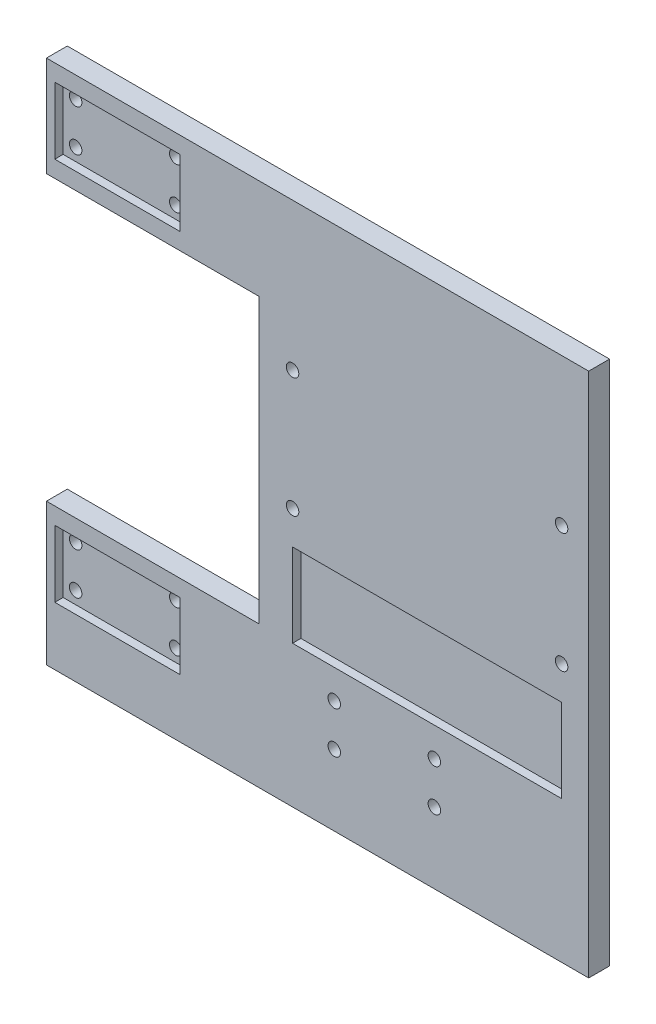
from build123d import *

# Parameters (mm, degrees)
EXTRUDE_2_DEPTH      = 5
SKETCH_3_W           = 30
SKETCH_3_H           = 16.1
CUT_EXTRUDE_1_DEPTH  = 2
CUT_EXTRUDE_2_REACH  = 155.704
SKETCH_4_R           = 1.55
CUT_EXTRUDE_3_REACH  = 155.756
SKETCH_5_W           = 32
SKETCH_5_H           = 56
SKETCH_7_W           = 40.5
SKETCH_7_H           = 40.5
EXTRUDE_4_DEPTH      = 2
SKETCH_8_W           = 30.5
SKETCH_8_H           = 16.5
CUT_EXTRUDE_4_DEPTH  = 2
SKETCH_9_R           = 1.55
CUT_EXTRUDE_6_DEPTH  = 154.727030805
SKETCH_10_W          = 60
SKETCH_10_H          = 45
EXTRUDE_5_DEPTH      = 2
SKETCH_11_W          = 60
SKETCH_11_H          = 45
CUT_EXTRUDE_8_DEPTH  = 2
SKETCH_12_W          = 30
SKETCH_12_H          = 16.1
SKETCH_12_W_2        = 30.5
SKETCH_12_H_2        = 16.5
EXTRUDE_6_DEPTH      = 5
SKETCH_13_R          = 1.5
CUT_EXTRUDE_10_DEPTH = 5
SKETCH_14_W          = 30
SKETCH_14_H          = 16
CUT_EXTRUDE_11_DEPTH = 2
SKETCH_15_W          = 53
SKETCH_15_H          = 60
SKETCH_15_W_2        = 49
SKETCH_15_H_2        = 56
CUT_EXTRUDE_12_DEPTH = 5
SKETCH_16_W          = 30
SKETCH_16_H          = 16
CUT_EXTRUDE_13_DEPTH = 2
SKETCH_17_R          = 1.5
CUT_EXTRUDE_15_DEPTH = 154.704261489
EXTRUDE_7_DEPTH      = 5
SKETCH_19_W          = 30
SKETCH_19_H          = 16
EXTRUDE_8_DEPTH      = 5
SKETCH_20_W          = 72
SKETCH_20_H          = 36.7
SKETCH_20_W_2        = 30
SKETCH_20_H_2        = 16
CUT_EXTRUDE_17_DEPTH = 2
SKETCH_21_R          = 1.5
CUT_EXTRUDE_18_DEPTH = 162.632298752
SKETCH_22_R          = 1.5
EXTRUDE_10_DEPTH     = 3
SKETCH_23_R          = 1.5
CUT_EXTRUDE_19_DEPTH = 162.632298752
SKETCH_24_W          = 72
SKETCH_24_H          = 36.7
SKETCH_24_R          = 1.5
EXTRUDE_11_DEPTH     = 5
SKETCH_26_W          = 30
SKETCH_26_H          = 16
SKETCH_26_R          = 1.5
EXTRUDE_12_DEPTH     = 5
SKETCH_27_W          = 51
SKETCH_27_H          = 4
CUT_EXTRUDE_22_DEPTH = 5
SKETCH_29_W          = 64.5
SKETCH_29_H          = 20
CUT_EXTRUDE_24_DEPTH = 2


with BuildPart() as part:
    # 草图1 → 凸台-拉伸2 (new body)
    with BuildSketch(Plane.XY):
        Polygon((0, 0), (0, 30), (120, 30), (120, -96), (0, -96), (0, -56), (45, -56), (45, 0), align=None)
    extrude(amount=EXTRUDE_2_DEPTH)

    # 草图3 → 切除-拉伸1 (cut)
    with BuildSketch(Plane.XY.offset(5)):
        with Locations((17, 10)):
            Rectangle(SKETCH_3_W, SKETCH_3_H)
        with Locations((17, -66)):
            Rectangle(SKETCH_3_W, SKETCH_3_H)
    extrude(amount=-CUT_EXTRUDE_1_DEPTH, mode=Mode.SUBTRACT)

    # 草图4 → 切除-拉伸2 (cut, up to next)
    with BuildSketch(Plane.XY.offset(3), mode=Mode.PRIVATE) as cut_extrude_2_sk1:
        with Locations((29, 15)):
            Circle(SKETCH_4_R)
    cut_extrude_2_tool1 = extrude(cut_extrude_2_sk1.sketch, amount=-CUT_EXTRUDE_2_REACH, mode=Mode.PRIVATE) & part.part
    # 草图4 → 切除-拉伸2 (cut, up to next)
    with BuildSketch(Plane.XY.offset(3), mode=Mode.PRIVATE) as cut_extrude_2_sk2:
        with Locations((29, 5)):
            Circle(SKETCH_4_R)
    cut_extrude_2_tool2 = extrude(cut_extrude_2_sk2.sketch, amount=-CUT_EXTRUDE_2_REACH, mode=Mode.PRIVATE) & part.part
    # 草图4 → 切除-拉伸2 (cut, up to next)
    with BuildSketch(Plane.XY.offset(3), mode=Mode.PRIVATE) as cut_extrude_2_sk3:
        with BuildLine():
            ThreePointArc((5, 16.55), (3.903984489, 16.096015511), (3.45, 15))
            Line((3.45, 15), (5, 15))
            Line((5, 15), (5, 16.55))
        make_face()
    cut_extrude_2_tool3 = extrude(cut_extrude_2_sk3.sketch, amount=-CUT_EXTRUDE_2_REACH, mode=Mode.PRIVATE) & part.part
    # 草图4 → 切除-拉伸2 (cut, up to next)
    with BuildSketch(Plane.XY.offset(3), mode=Mode.PRIVATE) as cut_extrude_2_sk4:
        with BuildLine():
            Line((5, 15), (3.45, 15))
            ThreePointArc((3.45, 15), (5, 13.45), (6.55, 15))
            ThreePointArc((6.55, 15), (6.096015511, 16.096015511), (5, 16.55))
            Line((5, 16.55), (5, 15))
        make_face()
    cut_extrude_2_tool4 = extrude(cut_extrude_2_sk4.sketch, amount=-CUT_EXTRUDE_2_REACH, mode=Mode.PRIVATE) & part.part
    # 草图4 → 切除-拉伸2 (cut, up to next)
    with BuildSketch(Plane.XY.offset(3), mode=Mode.PRIVATE) as cut_extrude_2_sk5:
        with BuildLine():
            ThreePointArc((5, 16.55), (3.903984489, 16.096015511), (3.45, 15))
            Line((3.45, 15), (5, 15))
            Line((5, 15), (5, 16.55))
        make_face()
    cut_extrude_2_tool5 = extrude(cut_extrude_2_sk5.sketch, amount=-CUT_EXTRUDE_2_REACH, mode=Mode.PRIVATE) & part.part
    # 草图4 → 切除-拉伸2 (cut, up to next)
    with BuildSketch(Plane.XY.offset(3), mode=Mode.PRIVATE) as cut_extrude_2_sk6:
        with BuildLine():
            Line((5, 15), (3.45, 15))
            ThreePointArc((3.45, 15), (5, 13.45), (6.55, 15))
            ThreePointArc((6.55, 15), (6.096015511, 16.096015511), (5, 16.55))
            Line((5, 16.55), (5, 15))
        make_face()
    cut_extrude_2_tool6 = extrude(cut_extrude_2_sk6.sketch, amount=-CUT_EXTRUDE_2_REACH, mode=Mode.PRIVATE) & part.part
    # 草图4 → 切除-拉伸2 (cut, up to next)
    with BuildSketch(Plane.XY.offset(3), mode=Mode.PRIVATE) as cut_extrude_2_sk7:
        with Locations((5, 5)):
            Circle(SKETCH_4_R)
    cut_extrude_2_tool7 = extrude(cut_extrude_2_sk7.sketch, amount=-CUT_EXTRUDE_2_REACH, mode=Mode.PRIVATE) & part.part
    # 草图4 → 切除-拉伸2 (cut, up to next)
    with BuildSketch(Plane.XY.offset(3), mode=Mode.PRIVATE) as cut_extrude_2_sk8:
        with Locations((5, -61)):
            Circle(SKETCH_4_R)
    cut_extrude_2_tool8 = extrude(cut_extrude_2_sk8.sketch, amount=-CUT_EXTRUDE_2_REACH, mode=Mode.PRIVATE) & part.part
    # 草图4 → 切除-拉伸2 (cut, up to next)
    with BuildSketch(Plane.XY.offset(3), mode=Mode.PRIVATE) as cut_extrude_2_sk9:
        with Locations((5, -71)):
            Circle(SKETCH_4_R)
    cut_extrude_2_tool9 = extrude(cut_extrude_2_sk9.sketch, amount=-CUT_EXTRUDE_2_REACH, mode=Mode.PRIVATE) & part.part
    # 草图4 → 切除-拉伸2 (cut, up to next)
    with BuildSketch(Plane.XY.offset(3), mode=Mode.PRIVATE) as cut_extrude_2_sk10:
        with Locations((29, -61)):
            Circle(SKETCH_4_R)
    cut_extrude_2_tool10 = extrude(cut_extrude_2_sk10.sketch, amount=-CUT_EXTRUDE_2_REACH, mode=Mode.PRIVATE) & part.part
    # 草图4 → 切除-拉伸2 (cut, up to next)
    with BuildSketch(Plane.XY.offset(3), mode=Mode.PRIVATE) as cut_extrude_2_sk11:
        with Locations((29, -71)):
            Circle(SKETCH_4_R)
    cut_extrude_2_tool11 = extrude(cut_extrude_2_sk11.sketch, amount=-CUT_EXTRUDE_2_REACH, mode=Mode.PRIVATE) & part.part
    add(cut_extrude_2_tool1.solids().sort_by_distance((29, 15, 3))[0], mode=Mode.SUBTRACT)
    add(cut_extrude_2_tool2.solids().sort_by_distance((29, 5, 3))[0], mode=Mode.SUBTRACT)
    add(cut_extrude_2_tool3.solids().sort_by_distance((4.34216, 15.65784, 3))[0], mode=Mode.SUBTRACT)
    add(cut_extrude_2_tool4.solids().sort_by_distance((5.21928, 14.78072, 3))[0], mode=Mode.SUBTRACT)
    add(cut_extrude_2_tool5.solids().sort_by_distance((4.34216, 15.65784, 3))[0], mode=Mode.SUBTRACT)
    add(cut_extrude_2_tool6.solids().sort_by_distance((5.21928, 14.78072, 3))[0], mode=Mode.SUBTRACT)
    add(cut_extrude_2_tool7.solids().sort_by_distance((5, 5, 3))[0], mode=Mode.SUBTRACT)
    add(cut_extrude_2_tool8.solids().sort_by_distance((5, -61, 3))[0], mode=Mode.SUBTRACT)
    add(cut_extrude_2_tool9.solids().sort_by_distance((5, -71, 3))[0], mode=Mode.SUBTRACT)
    add(cut_extrude_2_tool10.solids().sort_by_distance((29, -61, 3))[0], mode=Mode.SUBTRACT)
    add(cut_extrude_2_tool11.solids().sort_by_distance((29, -71, 3))[0], mode=Mode.SUBTRACT)

    # 草图5 → 切除-拉伸3 (cut, up to next)
    with BuildSketch(Plane.XY.offset(5), mode=Mode.PRIVATE) as cut_extrude_3_sk1:
        with Locations((33, -28)):
            Rectangle(SKETCH_5_W, SKETCH_5_H)
    cut_extrude_3_tool1 = extrude(cut_extrude_3_sk1.sketch, amount=-CUT_EXTRUDE_3_REACH, mode=Mode.PRIVATE) & part.part
    add(cut_extrude_3_tool1.solids().sort_by_distance((33, -28, 5))[0], mode=Mode.SUBTRACT)

    # 草图7 → 凸台-拉伸4 (add)
    with BuildSketch(Plane.XY.offset(5)):
        with Locations((79.25, -35.75)):
            Rectangle(SKETCH_7_W, SKETCH_7_H)
    extrude(amount=EXTRUDE_4_DEPTH)

    # 草图8 → 切除-拉伸4 (cut)
    with BuildSketch(Plane.XY.offset(5)):
        with Locations((69.5, -70.5)):
            Rectangle(SKETCH_8_W, SKETCH_8_H)
    extrude(amount=-CUT_EXTRUDE_4_DEPTH, mode=Mode.SUBTRACT)

    # 草图9 → 切除-拉伸6 (cut, through all)
    with BuildSketch(Plane.XY.offset(3)):
        with Locations((81.5, -65.5)):
            Circle(SKETCH_9_R)
        with Locations((57.5, -65.5)):
            Circle(SKETCH_9_R)
        with Locations(Location((57.5, -75.5, 0), (0, 0, 180))):
            Circle(SKETCH_9_R)
        with Locations((81.5, -75.5)):
            Circle(SKETCH_9_R)
    extrude(amount=-CUT_EXTRUDE_6_DEPTH, mode=Mode.SUBTRACT)

    # 草图10 → 凸台-拉伸5 (add)
    with BuildSketch(Plane.XY.offset(7)):
        with Locations((89, -33.5)):
            Rectangle(SKETCH_10_W, SKETCH_10_H)
    extrude(amount=-EXTRUDE_5_DEPTH)

    # 草图11 → 切除-拉伸8 (cut)
    with BuildSketch(Plane.XY.offset(5)):
        with Locations((89, -33.5)):
            Rectangle(SKETCH_11_W, SKETCH_11_H)
    extrude(amount=CUT_EXTRUDE_8_DEPTH, mode=Mode.SUBTRACT)

    # 草图12 → 凸台-拉伸6 (add)
    with BuildSketch(Plane.XY.offset(5)):
        with Locations((17, 10)):
            Rectangle(SKETCH_12_W, SKETCH_12_H)
        with Locations((17, -66)):
            Rectangle(SKETCH_12_W, SKETCH_12_H)
        with Locations((69.5, -70.5)):
            Rectangle(SKETCH_12_W_2, SKETCH_12_H_2)
    extrude(amount=-EXTRUDE_6_DEPTH)

    # 草图13 → 切除-拉伸10 (cut)
    with BuildSketch(Plane.XY.offset(5)):
        with Locations((5, -69)):
            Circle(SKETCH_13_R)
        with Locations((5, -79)):
            Circle(SKETCH_13_R)
        with Locations((29, 13)):
            Circle(SKETCH_13_R)
        with Locations((29, 23)):
            Circle(SKETCH_13_R)
        with Locations((5, 13)):
            Circle(SKETCH_13_R)
        with Locations((29, -79)):
            Circle(SKETCH_13_R)
        with Locations(Location((29, -69, 0), (0, 0, 180))):
            Circle(SKETCH_13_R)
        with Locations((5, 23)):
            Circle(SKETCH_13_R)
    extrude(amount=-CUT_EXTRUDE_10_DEPTH, mode=Mode.SUBTRACT)

    # 草图14 → 切除-拉伸11 (cut)
    with BuildSketch(Plane.XY.offset(5)):
        with Locations((17, 18)):
            Rectangle(SKETCH_14_W, SKETCH_14_H)
        with Locations((17, -74)):
            Rectangle(SKETCH_14_W, SKETCH_14_H)
    extrude(amount=-CUT_EXTRUDE_11_DEPTH, mode=Mode.SUBTRACT)

    # 草图15 → 切除-拉伸12 (cut)
    with BuildSketch(Plane.XY.offset(5)):
        with Locations((24.5, -28)):
            Rectangle(SKETCH_15_W, SKETCH_15_H)
        with Locations((24.5, -28)):
            Rectangle(SKETCH_15_W_2, SKETCH_15_H_2, mode=Mode.SUBTRACT)
    extrude(amount=-CUT_EXTRUDE_12_DEPTH, mode=Mode.SUBTRACT)

    # 草图16 → 切除-拉伸13 (cut)
    with BuildSketch(Plane.XY.offset(5)):
        with Locations((76, -74)):
            Rectangle(SKETCH_16_W, SKETCH_16_H)
    extrude(amount=-CUT_EXTRUDE_13_DEPTH, mode=Mode.SUBTRACT)

    # 草图17 → 切除-拉伸15 (cut, through all)
    with BuildSketch(Plane.XY.offset(3)):
        with Locations((88, -69)):
            Circle(SKETCH_17_R)
        with Locations((88, -79)):
            Circle(SKETCH_17_R)
        with Locations((64, -79)):
            Circle(SKETCH_17_R)
        with Locations((64, -69)):
            Circle(SKETCH_17_R)
    extrude(amount=-CUT_EXTRUDE_15_DEPTH, mode=Mode.SUBTRACT)

    # 草图18 → 凸台-拉伸7 (add)
    with BuildSketch(Plane.XY.offset(5)):
        Polygon((120, 30), (120, -46), (120, -96), (130, -96), (130, 30), align=None)
    extrude(amount=-EXTRUDE_7_DEPTH)

    # 草图19 → 凸台-拉伸8 (add)
    with BuildSketch(Plane.XY.offset(5)):
        with Locations((76, -74)):
            Rectangle(SKETCH_19_W, SKETCH_19_H)
    extrude(amount=-EXTRUDE_8_DEPTH)

    # 草图20 → 切除-拉伸17 (cut)
    with BuildSketch(Plane.XY.offset(5)):
        with Locations((91, -19.65)):
            Rectangle(SKETCH_20_W, SKETCH_20_H)
        with Locations((81, -74)):
            Rectangle(SKETCH_20_W_2, SKETCH_20_H_2)
    extrude(amount=-CUT_EXTRUDE_17_DEPTH, mode=Mode.SUBTRACT)

    # 草图21 → 切除-拉伸18 (cut, through all)
    with BuildSketch(Plane.XY.offset(3)):
        with BuildLine():
            ThreePointArc((60.5, -5.3), (60.060660172, -4.239339828), (59, -3.8))
            Line((59, -3.8), (59, -5.3))
            Line((59, -5.3), (57.5, -5.3))
            ThreePointArc((57.5, -5.3), (59, -6.8), (60.5, -5.3))
        make_face()
        with BuildLine():
            Line((59, -5.3), (59, -3.8))
            ThreePointArc((59, -3.8), (57.939339828, -4.239339828), (57.5, -5.3))
            Line((57.5, -5.3), (59, -5.3))
        make_face()
        with Locations((59, -34)):
            Circle(SKETCH_21_R)
        with Locations((123, -34)):
            Circle(SKETCH_21_R)
        with Locations((123, -5.3)):
            Circle(SKETCH_21_R)
        with Locations((93, -69)):
            Circle(SKETCH_21_R)
        with Locations((69, -79)):
            Circle(SKETCH_21_R)
        with Locations((93, -79)):
            Circle(SKETCH_21_R)
        with Locations((69, -69)):
            Circle(SKETCH_21_R)
    extrude(amount=-CUT_EXTRUDE_18_DEPTH, mode=Mode.SUBTRACT)

    # 草图22 → 凸台-拉伸10 (add)
    with BuildSketch(Plane.XY.offset(3)):
        with Locations((123, -5.3)):
            Circle(SKETCH_22_R)
        with Locations((123, -34)):
            Circle(SKETCH_22_R)
    extrude(amount=-EXTRUDE_10_DEPTH)

    # 草图23 → 切除-拉伸19 (cut, through all)
    with BuildSketch(Plane.XY.offset(3)):
        with BuildLine():
            ThreePointArc((125, -5.3), (124.560660172, -4.239339828), (123.5, -3.8))
            Line((123.5, -3.8), (123.5, -5.3))
            Line((123.5, -5.3), (125, -5.3))
        make_face()
        with BuildLine():
            Line((123.5, -5.3), (123.5, -3.8))
            ThreePointArc((123.5, -3.8), (122.439339828, -6.360660172), (125, -5.3))
            Line((125, -5.3), (123.5, -5.3))
        make_face()
        with Locations((123.5, -34)):
            Circle(SKETCH_23_R)
    extrude(amount=-CUT_EXTRUDE_19_DEPTH, mode=Mode.SUBTRACT)

    # 草图24 → 凸台-拉伸11 (add)
    with BuildSketch(Plane.XY.offset(5)):
        with Locations((91, -19.65)):
            Rectangle(SKETCH_24_W, SKETCH_24_H)
        with Locations((59, -5.3)):
            Circle(SKETCH_24_R, mode=Mode.SUBTRACT)
        with Locations((123.5, -5.3)):
            Circle(SKETCH_24_R, mode=Mode.SUBTRACT)
        with Locations((123.5, -34)):
            Circle(SKETCH_24_R, mode=Mode.SUBTRACT)
        with Locations((59, -34)):
            Circle(SKETCH_24_R, mode=Mode.SUBTRACT)
    extrude(amount=-EXTRUDE_11_DEPTH)

    # 草图26 → 凸台-拉伸12 (add)
    with BuildSketch(Plane.XY.offset(5)):
        with Locations((81, -74)):
            Rectangle(SKETCH_26_W, SKETCH_26_H)
        with Locations((69, -69)):
            Circle(SKETCH_26_R, mode=Mode.SUBTRACT)
        with Locations((69, -79)):
            Circle(SKETCH_26_R, mode=Mode.SUBTRACT)
        with Locations((93, -79)):
            Circle(SKETCH_26_R, mode=Mode.SUBTRACT)
        with Locations((93, -69)):
            Circle(SKETCH_26_R, mode=Mode.SUBTRACT)
    extrude(amount=-EXTRUDE_12_DEPTH)

    # 草图27 → 切除-拉伸22 (cut)
    with BuildSketch(Plane.XY.offset(5)):
        with Locations((25.5, 4)):
            Rectangle(SKETCH_27_W, SKETCH_27_H)
        with Locations((25.5, -60)):
            Rectangle(SKETCH_27_W, SKETCH_27_H)
    extrude(amount=-CUT_EXTRUDE_22_DEPTH, mode=Mode.SUBTRACT)

    # 草图29 → 切除-拉伸24 (cut)
    with BuildSketch(Plane.XY.offset(5)):
        with Locations((91.25, -52)):
            Rectangle(SKETCH_29_W, SKETCH_29_H)
    extrude(amount=-CUT_EXTRUDE_24_DEPTH, mode=Mode.SUBTRACT)


solid = part.part
